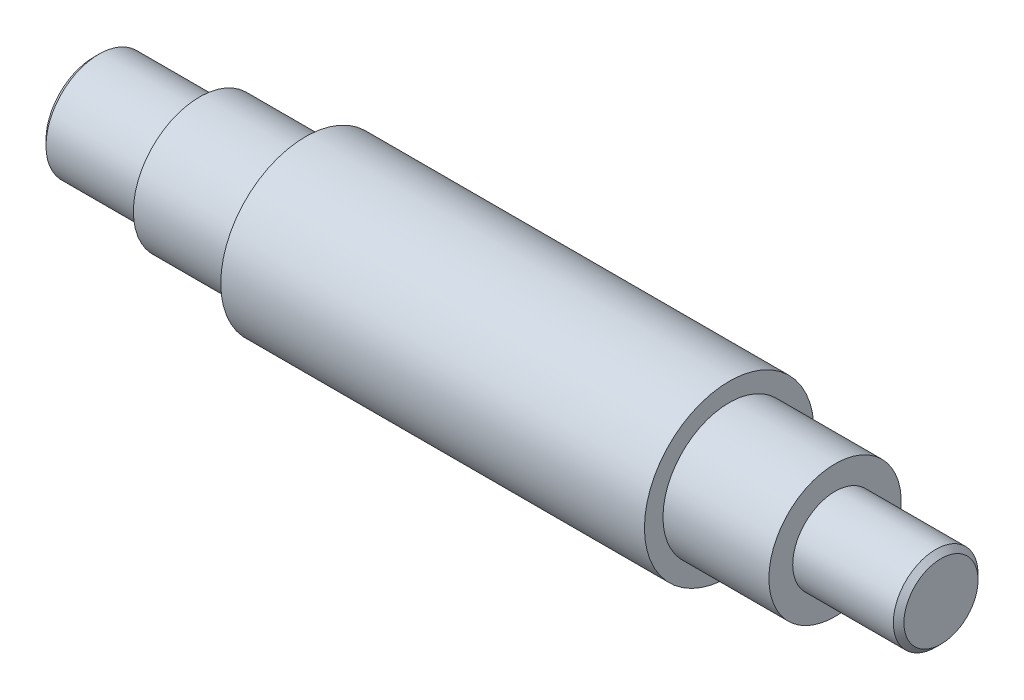
from build123d import *


with BuildPart() as part:
    # Skizze1 → Welle (revolve)
    with BuildSketch(Plane.XY, mode=Mode.PRIVATE) as welle_sk:
        Polygon((0, 0), (0, 9), (1, 10), (20, 10), (20, 12.5), (40, 12.5), (40, 16), (120, 16), (120, 12.5), (140, 12.5), (140, 8), (159, 8), (160, 7), (160, 0), align=None)
    revolve(welle_sk.sketch.rotate(Axis((-5, 0, 0), (1, 0, 0)), 90), axis=Axis((-5, 0, 0), (1, 0, 0)))


solid = part.part
